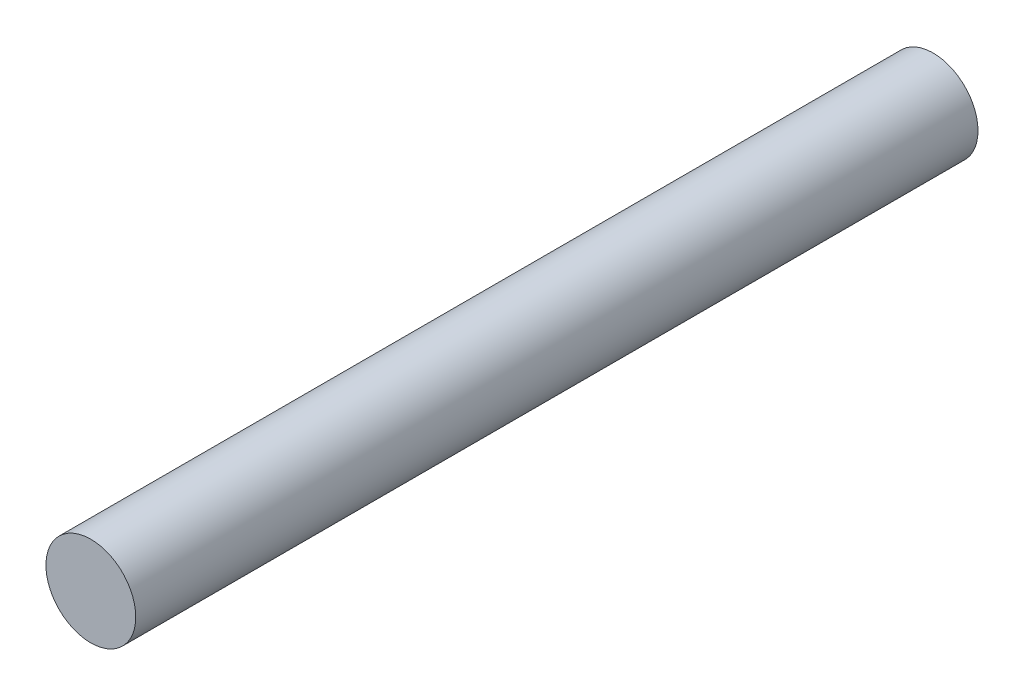
from build123d import *

# Parameters (mm, degrees)
SKETCH1_R           = 16
BOSS_EXTRUDE1_DEPTH = 300


with BuildPart() as part:
    # Sketch1 → Boss-Extrude1 (new body)
    with BuildSketch(Plane.XY):
        Circle(SKETCH1_R)
    extrude(amount=BOSS_EXTRUDE1_DEPTH)


solid = part.part
